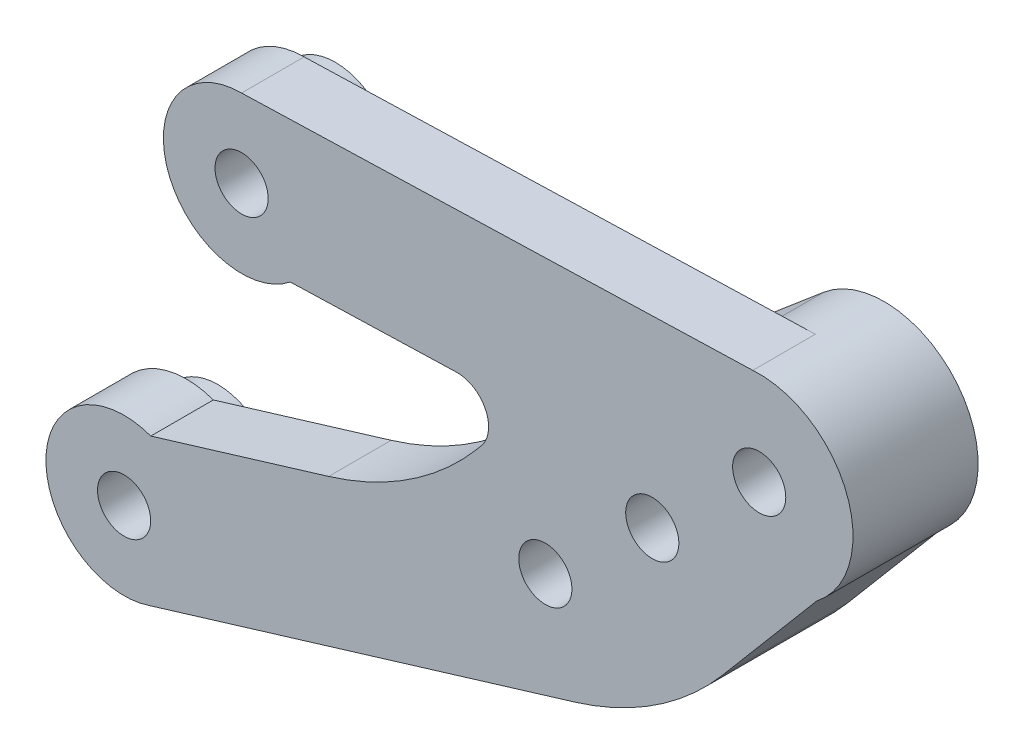
from build123d import *

# Parameters (mm, degrees)
BOSS_EXTRUDE1_DEPTH      = 2
BOSS_EXTRUDE1_DEPTH_BACK = 2
SKETCH2_R                = 1.7
FILLET1_R                = 20
BOSS_EXTRUDE4_START      = 4
SKETCH7_R                = 1.7
BOSS_EXTRUDE4_DEPTH      = 4
BOSS_EXTRUDE5_START      = 2
SKETCH8_R                = 3.7
SKETCH8_R_2              = 1.7
BOSS_EXTRUDE5_DEPTH      = 2
FILLET4_R                = 2
SKETCH9_R                = 1.7
CUT_EXTRUDE1_DEPTH       = 55.759144692


with BuildPart() as part:
    # Sketch2 → Boss-Extrude1 (new, two sides: drawn at the far end of the back side and taken through both)
    with BuildSketch(Plane.XY.offset(-BOSS_EXTRUDE1_DEPTH_BACK)):
        with BuildLine():
            Line((1.575752274, -4.745208612), (34.456924853, 5.232629629))
            Line((34.456924853, 5.232629629), (44.296635241, 16.864742156))
            ThreePointArc((44.296635241, 16.864742156), (46.218376178, 23.740514028), (40.203783054, 27.586810508))
            Line((40.203783054, 27.586810508), (7.512886707, 26.600773906))
            ThreePointArc((7.512886707, 26.600773906), (2.79322071, 19.950091357), (10.629154827, 17.690675057))
            Line((10.629154827, 17.690675057), (25.733767379, 18.146266751))
            Line((25.733767379, 18.146266751), (18.728666276, 9.86511608))
            Line((18.728666276, 9.86511608), (1.70658462, 4.699741369))
            ThreePointArc((1.70658462, 4.699741369), (-4.999520368, 0.069253832), (1.575752274, -4.745208612))
        make_face()
        Circle(SKETCH2_R, mode=Mode.SUBTRACT)
        with Locations((40.612886707, 21.600773906)):
            Circle(SKETCH2_R, mode=Mode.SUBTRACT)
        with Locations((7.512886707, 21.600773906)):
            Circle(SKETCH2_R, mode=Mode.SUBTRACT)
    extrude(amount=BOSS_EXTRUDE1_DEPTH + BOSS_EXTRUDE1_DEPTH_BACK)

    # Fillet1
    fillet1_edges = [part.edges().sort_by_distance(p)[0] for p in [
        (34.456924853, 5.232629629, 0),
        (18.728666276, 9.86511608, 0),
    ]]
    fillet(fillet1_edges, radius=FILLET1_R)

    # Sketch7 → Boss-Extrude4 (add)
    with BuildSketch(Plane(origin=(0, 0, -2), x_dir=(-1, 0, 0), z_dir=(0, 0, -1)).offset(BOSS_EXTRUDE4_START)):
        with BuildLine():
            Line((-36.733417778, 26.177860406), (-21.683989193, 13.422192867))
            ThreePointArc((-21.683989193, 13.422192867), (-21.70362245, 5.922427438), (-28.807655282, 3.518350802))
            ThreePointArc((-28.807655282, 3.518350802), (-33.988212002, 5.945467438), (-38.269694349, 9.739933408))
            Line((-38.269694349, 9.739933408), (-44.296635241, 16.864742156))
            ThreePointArc((-44.296635241, 16.864742156), (-45.270474012, 25.383217626), (-36.733417778, 26.177860406))
        make_face()
        with Locations(Location((-40.612886707, 21.600773906, 0), (0, 0, 180))):
            Circle(SKETCH7_R, mode=Mode.SUBTRACT)
    extrude(amount=-BOSS_EXTRUDE4_DEPTH)

    # Sketch8 → Boss-Extrude5 (add)
    # profile 1 of 2: a face of its own
    with BuildSketch(Plane(origin=(0, 0, -2), x_dir=(-1, 0, 0), z_dir=(0, 0, -1)).offset(BOSS_EXTRUDE5_START)):
        with Locations(Location((-7.512886707, 21.600773906, 0), (0, 0, 180))):
            Circle(SKETCH8_R)
        with Locations(Location((-7.512886707, 21.600773906, 0), (0, 0, 180))):
            Circle(SKETCH8_R_2, mode=Mode.SUBTRACT)
    # profile 2 of 2: a face of its own
    with BuildSketch(Plane(origin=(0, 0, -2), x_dir=(-1, 0, 0), z_dir=(0, 0, -1)).offset(BOSS_EXTRUDE5_START)):
        with Locations(Location((0, 0, 0), (0, 0, 180))):
            Circle(SKETCH8_R)
        with Locations(Location((0, 0, 0), (0, 0, 180))):
            Circle(SKETCH8_R_2, mode=Mode.SUBTRACT)
    extrude(amount=-BOSS_EXTRUDE5_DEPTH)

    # Fillet4
    fillet4_edges = [part.edges().sort_by_distance(p)[0] for p in [
        (25.733767379, 18.146266751, 0),
    ]]
    fillet(fillet4_edges, radius=FILLET4_R)

    # Sketch9 → Cut-Extrude1 (cut, through all)
    with BuildSketch(Plane(origin=(0, 0, -6), x_dir=(-1, 0, 0), z_dir=(0, 0, -1))):
        with Locations((-33.774027465, 15.643013901)):
            Circle(SKETCH9_R)
        with Locations((-26.936063231, 9.686033593)):
            Circle(SKETCH9_R)
    extrude(amount=-CUT_EXTRUDE1_DEPTH, mode=Mode.SUBTRACT)


solid = part.part
